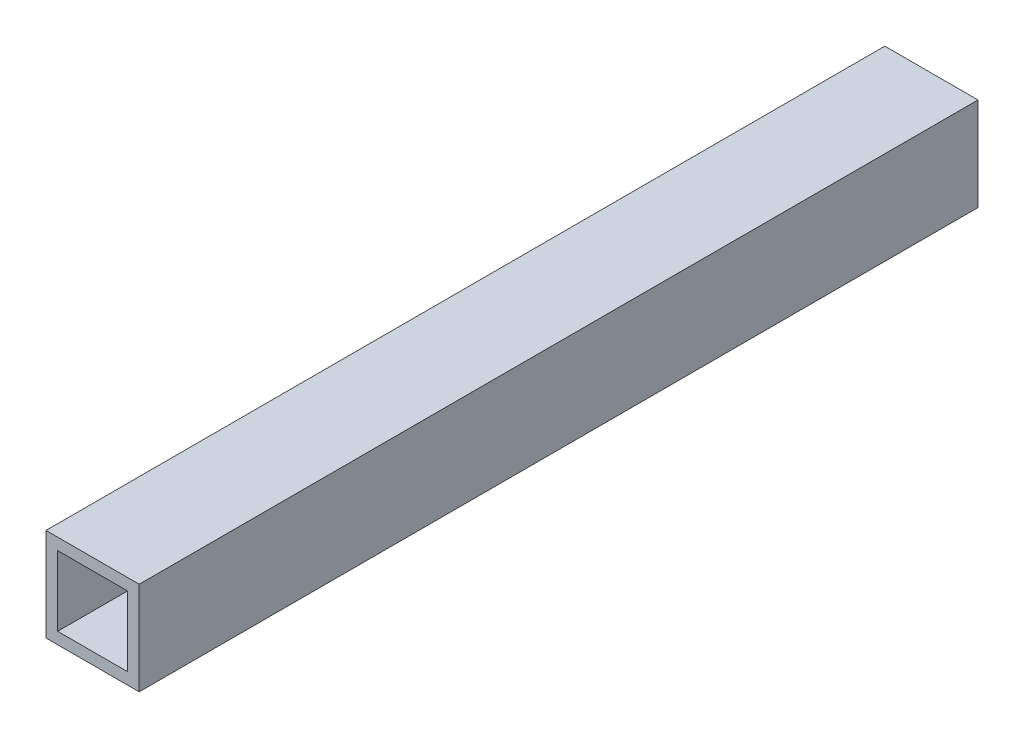
from build123d import *

# Parameters (mm, degrees)
BOSS_EXTRUDE1_DEPTH      = 114.3
BOSS_EXTRUDE1_DEPTH_BACK = 114.3
SKETCH3_W                = 25.4
SKETCH3_H                = 25.4
SKETCH3_W_2              = 19.05
SKETCH3_H_2              = 19.05


with BuildPart() as part:
    # Sketch3 → Boss-Extrude1 (new, two sides: drawn at the far end of the back side and taken through both)
    with BuildSketch(Plane.XY.offset(-BOSS_EXTRUDE1_DEPTH_BACK)):
        Rectangle(SKETCH3_W, SKETCH3_H)
        Rectangle(SKETCH3_W_2, SKETCH3_H_2, mode=Mode.SUBTRACT)
    extrude(amount=BOSS_EXTRUDE1_DEPTH + BOSS_EXTRUDE1_DEPTH_BACK)


solid = part.part
